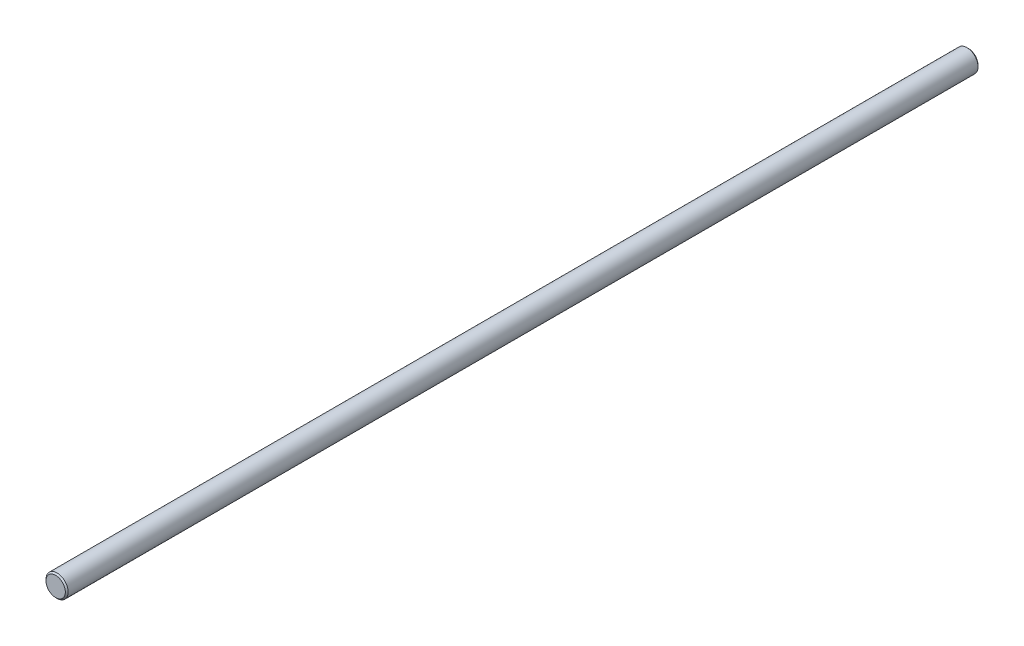
from build123d import *


with BuildPart() as part:
    # Sketch1 → Revolve1 (revolve)
    with BuildSketch(Plane.XZ, mode=Mode.PRIVATE) as revolve1_sk:
        Polygon((3.5, 330), (0, 330), (0, 0), (3.5, 0), (4, 0.5), (4, 329.5), align=None)
    revolve(revolve1_sk.sketch.rotate(Axis((0, 0, 330), (0, 0, -1)), 180), axis=Axis((0, 0, 330), (0, 0, -1)))


solid = part.part
